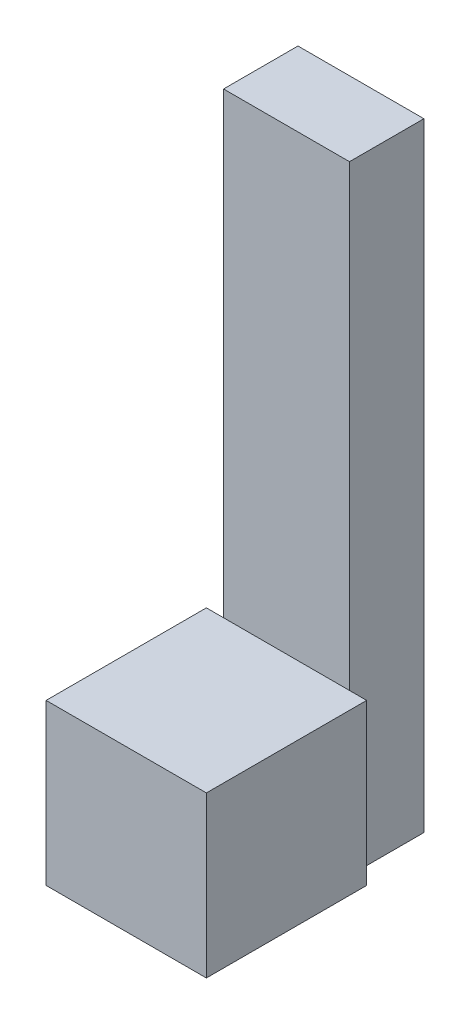
from build123d import *

# Parameters (mm, degrees)
SKETCH1_W           = 11
SKETCH1_H           = 54
BOSS_EXTRUDE1_DEPTH = 3.25
SKETCH2_W           = 14
SKETCH2_H           = 14
BOSS_EXTRUDE3_DEPTH = 14


with BuildPart() as part:
    # Sketch1 → Boss-Extrude1 (new, symmetric)
    with BuildSketch(Plane.XY):
        Rectangle(SKETCH1_W, SKETCH1_H)
    extrude(amount=BOSS_EXTRUDE1_DEPTH, both=True)

    # Sketch2 → Boss-Extrude3 (add)
    with BuildSketch(Plane.XY.offset(3.25)):
        with Locations((0, -20)):
            Rectangle(SKETCH2_W, SKETCH2_H)
    extrude(amount=BOSS_EXTRUDE3_DEPTH)


solid = part.part
